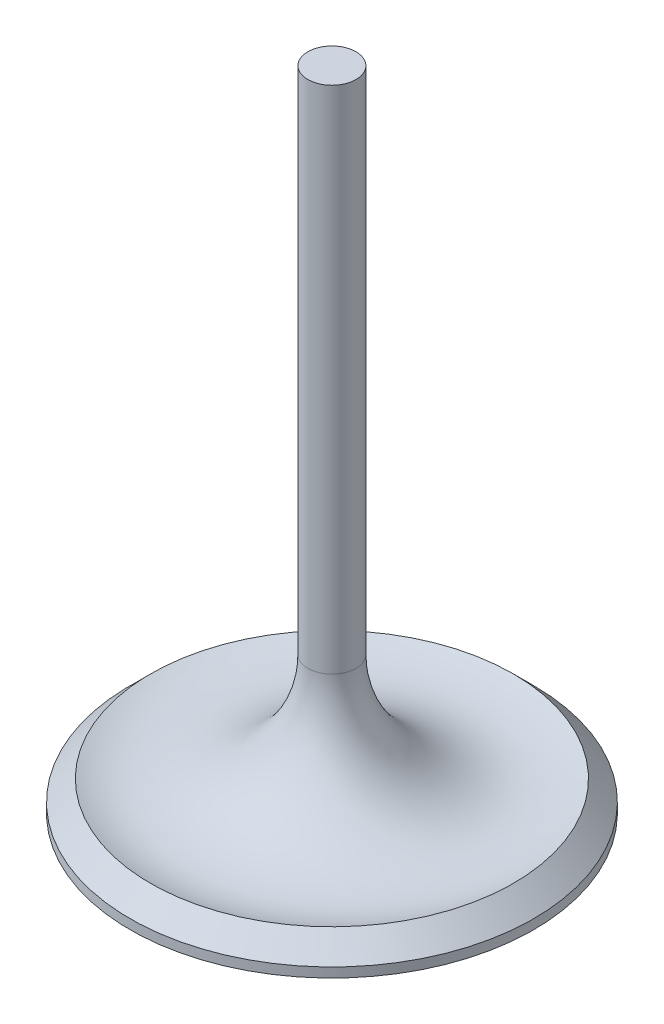
from build123d import *


with BuildPart() as part:
    # Sketch1 → Revolve1 (revolve)
    with BuildSketch(Plane.XY, mode=Mode.PRIVATE) as revolve1_sk:
        with BuildLine():
            Line((0, 0), (0, 85.55))
            Line((0, 85.55), (3.18, 85.55))
            Line((3.18, 85.55), (3.18, 18.169893823))
            ThreePointArc((3.18, 18.169893823), (9.828047554, 5.577478879), (23.975923164, 3.964076836))
            Line((23.975923164, 3.964076836), (26.67, 1.27))
            Line((26.67, 1.27), (26.67, 0))
            Line((26.67, 0), (0, 0))
        make_face()
    revolve(revolve1_sk.sketch.rotate(Axis((0, 0, 0), (0, 1, 0)), 90), axis=Axis((0, 0, 0), (0, 1, 0)))


solid = part.part
